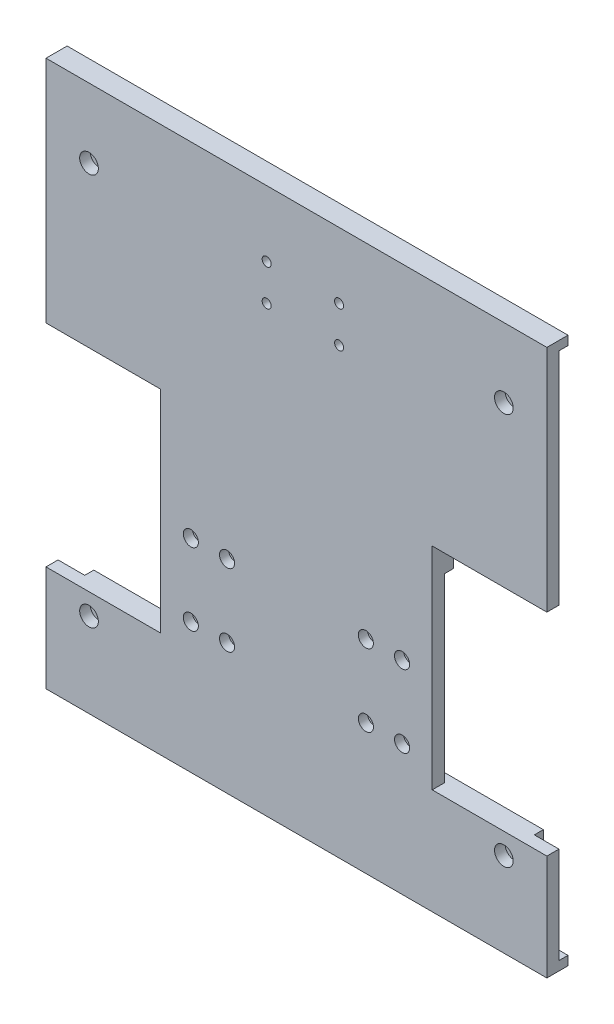
from build123d import *

# Parameters (mm, degrees)
SKETCH_1_W           = 150
SKETCH_1_H           = 160
EXTRUDE_1_DEPTH      = 7
SKETCH_2_W           = 30
SKETCH_2_H           = 70
CUT_EXTRUDE_1_DEPTH  = 10
SKETCH_3_R           = 1.5
CUT_EXTRUDE_2_DEPTH  = 10
SKETCH_4_R           = 1.5
CUT_EXTRUDE_3_DEPTH  = 10
SKETCH_5_R           = 2.5
CUT_EXTRUDE_4_DEPTH  = 3
SKETCH_6_R           = 1.5
CUT_EXTRUDE_5_DEPTH  = 10
CUT_EXTRUDE_6_DEPTH  = 0.5
SKETCH_10_W          = 70
SKETCH_10_H          = 3
EXTRUDE_2_DEPTH      = 10
CUT_EXTRUDE_11_DEPTH = 3
SKETCH_13_W          = 150
SKETCH_13_H          = 7
EXTRUDE_4_DEPTH      = 13
SKETCH_14_W          = 25
SKETCH_14_H          = 5
EXTRUDE_5_DEPTH      = 10
SKETCH_17_W          = 150
SKETCH_17_H          = 7
EXTRUDE_6_DEPTH      = 8
SKETCH_19_W          = 7
SKETCH_19_H          = 76
EXTRUDE_8_DEPTH      = 8
SKETCH_20_W          = 7
SKETCH_20_H          = 76
EXTRUDE_9_DEPTH      = 8
CUT_EXTRUDE_14_DEPTH = 3
SKETCH_27_W          = 7
SKETCH_27_H          = 35
EXTRUDE_14_DEPTH     = 8
SKETCH_28_W          = 7
SKETCH_28_H          = 35
EXTRUDE_15_DEPTH     = 8
CUT_EXTRUDE_15_DEPTH = 3
CUT_EXTRUDE_16_DEPTH = 2
SKETCH_30_R          = 1.6
CUT_EXTRUDE_17_DEPTH = 7
SKETCH_31_R          = 3.1
CUT_EXTRUDE_18_DEPTH = 3.5
SKETCH_32_R          = 2.5
CUT_EXTRUDE_19_DEPTH = 4


with BuildPart() as part:
    # 草圖1 → 填料-伸長1 (new body)
    with BuildSketch(Plane.XY):
        Rectangle(SKETCH_1_W, SKETCH_1_H)
    extrude(amount=EXTRUDE_1_DEPTH)

    # 草圖2 → 除料-伸長1 (cut)
    with BuildSketch(Plane(origin=(0, 0, 0), x_dir=(-1, 0, 0), z_dir=(0, 0, -1))):
        with Locations((-60, -23)):
            Rectangle(SKETCH_2_W, SKETCH_2_H)
        with Locations((60, -23)):
            Rectangle(SKETCH_2_W, SKETCH_2_H)
    extrude(amount=-CUT_EXTRUDE_1_DEPTH, mode=Mode.SUBTRACT)

    # 草圖3 → 除料-伸長2 (cut)
    with BuildSketch(Plane(origin=(0, 0, 0), x_dir=(-1, 0, 0), z_dir=(0, 0, -1))):
        with Locations((-35, -25.75)):
            Circle(SKETCH_3_R)
        with Locations((-23, -25.75)):
            Circle(SKETCH_3_R)
        with Locations((-35.024958581, -49.749987022)):
            Circle(SKETCH_3_R)
        with Locations((-23.024958581, -49.749987022)):
            Circle(SKETCH_3_R)
    extrude(amount=-CUT_EXTRUDE_2_DEPTH, mode=Mode.SUBTRACT)

    # 草圖4 → 除料-伸長3 (cut)
    with BuildSketch(Plane(origin=(0, 0, 0), x_dir=(-1, 0, 0), z_dir=(0, 0, -1))):
        with Locations((35, -25.75)):
            Circle(SKETCH_4_R)
        with Locations((23, -25.75)):
            Circle(SKETCH_4_R)
        with Locations((35, -49.75)):
            Circle(SKETCH_4_R)
        with Locations((23, -49.75)):
            Circle(SKETCH_4_R)
    extrude(amount=-CUT_EXTRUDE_3_DEPTH, mode=Mode.SUBTRACT)

    # 草圖5 → 除料-伸長4 (cut)
    with BuildSketch(Plane.XY.offset(7)):
        with Locations((-35, -25.75)):
            Circle(SKETCH_5_R)
        with Locations((-23, -25.75)):
            Circle(SKETCH_5_R)
        with Locations((-35, -49.75)):
            Circle(SKETCH_5_R)
        with Locations((-23, -49.75)):
            Circle(SKETCH_5_R)
        with Locations((23.024958581, -49.749987022)):
            Circle(SKETCH_5_R)
        with Locations((35.024958581, -49.749987022)):
            Circle(SKETCH_5_R)
        with Locations((35, -25.75)):
            Circle(SKETCH_5_R)
        with Locations((23, -25.75)):
            Circle(SKETCH_5_R)
    extrude(amount=-CUT_EXTRUDE_4_DEPTH, mode=Mode.SUBTRACT)

    # 草圖6 → 除料-伸長5 (cut)
    with BuildSketch(Plane(origin=(0, 0, 0), x_dir=(-1, 0, 0), z_dir=(0, 0, -1))):
        with Locations((-14.13500283, 66.177513248)):
            Circle(SKETCH_6_R)
        with Locations((9.86499717, 66.177513248)):
            Circle(SKETCH_6_R)
        with Locations((9.86499717, 54.177513248)):
            Circle(SKETCH_6_R)
        with Locations((-14.13500283, 54.177513248)):
            Circle(SKETCH_6_R)
    extrude(amount=-CUT_EXTRUDE_5_DEPTH, mode=Mode.SUBTRACT)

    # 草圖7 → 除料-伸長6 (cut)
    with BuildSketch(Plane(origin=(0, 0, 0), x_dir=(-1, 0, 0), z_dir=(0, 0, -1))):
        Polygon((72.33, -65), (70.54, -61.899629054), (66.96, -61.899629054), (65.17, -65), (66.96, -68.100370946), (70.54, -68.100370946), align=None)
        Polygon((72.33, 65), (70.54, 68.100370946), (66.96, 68.100370946), (65.17, 65), (66.96, 61.899629054), (70.54, 61.899629054), align=None)
        Polygon((-65.17, 65), (-66.96, 68.100370946), (-70.54, 68.100370946), (-72.33, 65), (-70.54, 61.899629054), (-66.96, 61.899629054), align=None)
        Polygon((-65.17, -65), (-66.96, -61.899629054), (-70.54, -61.899629054), (-72.33, -65), (-70.54, -68.100370946), (-66.96, -68.100370946), align=None)
    extrude(amount=-CUT_EXTRUDE_6_DEPTH, mode=Mode.SUBTRACT)

    # 草圖10 → 填料-伸長2 (add)
    with BuildSketch(Plane(origin=(0, 0, 0), x_dir=(-1, 0, 0), z_dir=(0, 0, -1))):
        with Locations((0, 71.189628596)):
            Rectangle(SKETCH_10_W, SKETCH_10_H)
    extrude(amount=EXTRUDE_2_DEPTH)

    # 草圖11 → 除料-伸長11 (cut)
    with BuildSketch(Plane(origin=(0, 0, 0), x_dir=(-1, 0, 0), z_dir=(0, 0, -1))):
        with BuildLine():
            Line((-35, 12), (35, 12))
            ThreePointArc((35, 12), (42.071067812, 9.071067812), (45, 2))
            Line((45, 2), (45, -58))
            Line((45, -58), (-45, -58))
            Line((-45, -58), (-45, 2))
            ThreePointArc((-45, 2), (-42.071067812, 9.071067812), (-35, 12))
        make_face()
    extrude(amount=-CUT_EXTRUDE_11_DEPTH, mode=Mode.SUBTRACT)

    # 草圖13 → 填料-伸長4 (add)
    with BuildSketch(Plane.XZ.offset(80)):
        with Locations((0, 3.5)):
            Rectangle(SKETCH_13_W, SKETCH_13_H)
    extrude(amount=EXTRUDE_4_DEPTH)

    # 草圖14 → 填料-伸長5 (add)
    with BuildSketch(Plane(origin=(0, 0, 0), x_dir=(-1, 0, 0), z_dir=(0, 0, -1))):
        with Locations((-47.5, 14.5)):
            Rectangle(SKETCH_14_W, SKETCH_14_H)
        with Locations((47.5, 14.5)):
            Rectangle(SKETCH_14_W, SKETCH_14_H)
    extrude(amount=EXTRUDE_5_DEPTH)

    # 草圖17 → 填料-伸長6 (add)
    with BuildSketch(Plane(origin=(0, 80, 0), x_dir=(1, 0, 0), z_dir=(0, 1, 0))):
        with Locations((0, -3.5)):
            Rectangle(SKETCH_17_W, SKETCH_17_H)
    extrude(amount=EXTRUDE_6_DEPTH)

    # 草圖19 → 填料-伸長8 (add)
    with BuildSketch(Plane(origin=(75, 0, 0), x_dir=(0, 0, -1), z_dir=(1, 0, 0))):
        with Locations((-3.5, 50)):
            Rectangle(SKETCH_19_W, SKETCH_19_H)
    extrude(amount=EXTRUDE_8_DEPTH)

    # 草圖20 → 填料-伸長9 (add)
    with BuildSketch(Plane.ZY.offset(75)):
        with Locations((3.5, 50)):
            Rectangle(SKETCH_20_W, SKETCH_20_H)
    extrude(amount=EXTRUDE_9_DEPTH)

    # 草圖26 → 除料-伸長14 (cut)
    with BuildSketch(Plane(origin=(0, 0, 0), x_dir=(-1, 0, 0), z_dir=(0, 0, -1))):
        Polygon((-83, 85), (-83, 12), (-74.5, 12), (-74.5, 79.5), (74.5, 79.5), (74.5, 12), (83, 12), (83, 85), align=None)
    extrude(amount=-CUT_EXTRUDE_14_DEPTH, mode=Mode.SUBTRACT)

    # 草圖27 → 填料-伸長14 (add)
    with BuildSketch(Plane(origin=(75, 0, 0), x_dir=(0, 0, -1), z_dir=(1, 0, 0))):
        with Locations((-3.5, -75.5)):
            Rectangle(SKETCH_27_W, SKETCH_27_H)
    extrude(amount=EXTRUDE_14_DEPTH)

    # 草圖28 → 填料-伸長15 (add)
    with BuildSketch(Plane.ZY.offset(75)):
        with Locations((3.5, -75.5)):
            Rectangle(SKETCH_28_W, SKETCH_28_H)
    extrude(amount=EXTRUDE_15_DEPTH)

    # 草圖29 → 除料-伸長15 (cut)
    with BuildSketch(Plane(origin=(0, 0, 0), x_dir=(-1, 0, 0), z_dir=(0, 0, -1))):
        Polygon((83, -58), (83, -90), (-83, -90), (-83, -58), (-74.841372547, -58), (-74.841372547, -84.5), (74.158627453, -84.5), (74.158627453, -58), align=None)
    extrude(amount=-CUT_EXTRUDE_15_DEPTH, mode=Mode.SUBTRACT)

    # 草圖8 → 除料-伸長16 (cut)
    with BuildSketch(Plane(origin=(0, 0, 0.5), x_dir=(-1, 0, 0), z_dir=(0, 0, -1))):
        Polygon((-65.75, 65), (-67.25, 67.598076211), (-70.25, 67.598076211), (-71.75, 65), (-70.25, 62.401923789), (-67.25, 62.401923789), align=None)
        Polygon((71.75, 65), (70.25, 67.598076211), (67.25, 67.598076211), (65.75, 65), (67.25, 62.401923789), (70.25, 62.401923789), align=None)
        Polygon((-65.75, -65), (-67.25, -62.401923789), (-70.25, -62.401923789), (-71.75, -65), (-70.25, -67.598076211), (-67.25, -67.598076211), align=None)
        Polygon((71.75, -65), (70.25, -62.401923789), (67.25, -62.401923789), (65.75, -65), (67.25, -67.598076211), (70.25, -67.598076211), align=None)
    extrude(amount=-CUT_EXTRUDE_16_DEPTH, mode=Mode.SUBTRACT)

    # 草圖30 → 除料-伸長17 (cut)
    with BuildSketch(Plane.XY):
        with Locations(Location((68.75, -65, 0), (0, 0, 180))):
            Circle(SKETCH_30_R)
        with Locations(Location((68.75, 65, 0), (0, 0, 180))):
            Circle(SKETCH_30_R)
        with Locations(Location((-68.75, -65, 0), (0, 0, 180))):
            Circle(SKETCH_30_R)
        with Locations(Location((-68.75, 65, 0), (0, 0, 180))):
            Circle(SKETCH_30_R)
    extrude(amount=CUT_EXTRUDE_17_DEPTH, mode=Mode.SUBTRACT)

    # 草圖31 → 除料-伸長18 (cut)
    with BuildSketch(Plane.XY.offset(7)):
        with Locations((-68.75, 65)):
            Circle(SKETCH_31_R)
        with Locations((-68.75, -65)):
            Circle(SKETCH_31_R)
        with Locations((68.75, -65)):
            Circle(SKETCH_31_R)
        with Locations((68.75, 65)):
            Circle(SKETCH_31_R)
    extrude(amount=-CUT_EXTRUDE_18_DEPTH, mode=Mode.SUBTRACT)

    # 草圖32 → 除料-伸長19 (cut)
    with BuildSketch(Plane(origin=(0, 0, 0), x_dir=(-1, 0, 0), z_dir=(0, 0, -1))):
        with Locations((-14.13500283, 66.177513248)):
            Circle(SKETCH_32_R)
        with Locations((-14.13500283, 54.177513248)):
            Circle(SKETCH_32_R)
        with Locations((9.86499717, 54.177513248)):
            Circle(SKETCH_32_R)
        with Locations((9.86499717, 66.177513248)):
            Circle(SKETCH_32_R)
    extrude(amount=-CUT_EXTRUDE_19_DEPTH, mode=Mode.SUBTRACT)


solid = part.part
